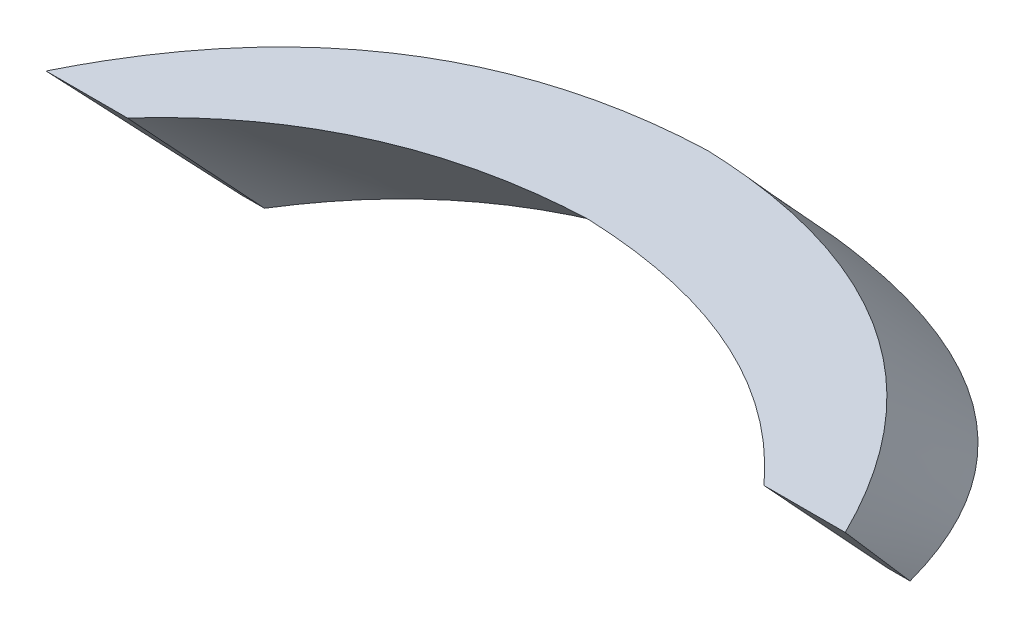
from build123d import *

# Parameters (mm, degrees)
BOSS_EXTRUDE1_DEPTH      = 76.2
BOSS_EXTRUDE2_DEPTH      = 25873.085069
BOSS_EXTRUDE2_DEPTH_BACK = 11480.154931
SKETCH6_R                = 2240.28
SKETCH6_R_2              = 2151.38
CUT_EXTRUDE2_DEPTH       = 40152.227650453
CUT_EXTRUDE2_DEPTH_BACK  = 40152.227650453
SKETCH9_R                = 2603.835118227
SKETCH9_R_2              = 2240.28
SKETCH16_R               = 2240.28
SKETCH17_R               = 355.259859159
SKETCH39_R               = 2240.28
BOSS_EXTRUDE5_DEPTH      = 1158.989431677
SKETCH40_W               = 22247.712993738
SKETCH40_H               = 18439.107036522
CUT_EXTRUDE9_DEPTH       = 47201.096742261


with BuildPart() as part:
    # Sketch4 → Boss-Extrude1 (new body)
    with BuildSketch(Plane(origin=(0, 0, 0), x_dir=(1, 0, 0), z_dir=(0, 1, 0))):
        with BuildLine():
            Line((-2240.28, 11480.154930676), (-2240.28, -25873.085069324))
            add(Edge.make_bspline(
                [(-2240.28, -25873.085069324), (-1878.626183949, -27707.433501437), (0, -28507.09818)],
                knots=[0, 0, 0, 1, 1, 1], degree=2))
            add(Edge.make_bspline(
                [(2240.28, -25873.085069324), (1878.62618395, -27707.433501437), (0, -28507.09818)],
                knots=[0, 0, 0, 1, 1, 1], degree=2))
            Line((2240.28, -25873.085069324), (2240.28, 11480.154930676))
            Line((2240.28, 11480.154930676), (-2240.28, 11480.154930676))
        make_face()
    extrude(amount=BOSS_EXTRUDE1_DEPTH)

    # Sketch6 → Boss-Extrude2 (add, two sides: drawn at the far end of the back side and taken through both)
    with BuildSketch(Plane.XY.offset(-BOSS_EXTRUDE2_DEPTH_BACK)):
        with Locations((0, 609.6)):
            Circle(SKETCH6_R)
        with Locations((0, 609.6)):
            Circle(SKETCH6_R_2, mode=Mode.SUBTRACT)
    extrude(amount=BOSS_EXTRUDE2_DEPTH + BOSS_EXTRUDE2_DEPTH_BACK)

    # Sketch9 → Cut-Extrude2 (cut, two sides: drawn at the far end of the back side and taken through both)
    with BuildSketch(Plane(origin=(0, 0, -11480.154930676), x_dir=(-1, 0, 0), z_dir=(0, 0, -1)).offset(-CUT_EXTRUDE2_DEPTH_BACK)):
        with Locations((0, 609.6)):
            Circle(SKETCH9_R)
        with Locations(Location((0, 609.6, 0), (0, 0, 346.225853002))):
            Circle(SKETCH9_R_2, mode=Mode.SUBTRACT)
    extrude(amount=CUT_EXTRUDE2_DEPTH + CUT_EXTRUDE2_DEPTH_BACK, mode=Mode.SUBTRACT)

    # Sketch16 → Loft1 section 0
    with BuildSketch(Plane.XY.offset(25873.085069324)):
        with Locations((0, 609.6)):
            Circle(SKETCH16_R)
    # Sketch15 → Loft1 section 1
    with BuildSketch(Plane.XY.offset(31657.776596271)):
        with BuildLine():
            add(Edge.make_bspline(
                [(0, 2543.01989867), (915.928720581, 2543.01989867), (2286.858534778, -200.689582198), (0, -503.660012782), (-2286.858534778, -200.689582198), (-915.928720581, 2543.01989867), (0, 2543.01989867)],
                knots=[0, 0, 0, 0, 0.334053834, 0.5, 0.665946166, 1, 1, 1, 1], degree=3))
        make_face()
    # Sketch17 → Loft1 section 2
    with BuildSketch(Plane.XY.offset(34418.206950084)):
        with Locations((0, 1489.004579609)):
            Circle(SKETCH17_R)
    loft()

    # Sketch39 → Boss-Extrude5 (add)
    with BuildSketch(Plane(origin=(0, 0, -11480.154930676), x_dir=(-1, 0, 0), z_dir=(0, 0, -1))):
        with Locations((0, 609.6)):
            Circle(SKETCH39_R)
    extrude(amount=BOSS_EXTRUDE5_DEPTH)

    # Sketch40 → Cut-Extrude9 (cut, through all)
    with BuildSketch(Plane(origin=(0, 0, -12639.144362353), x_dir=(-1, 0, 0), z_dir=(0, 0, -1))):
        Rectangle(SKETCH40_W, SKETCH40_H)
    extrude(amount=-CUT_EXTRUDE9_DEPTH, mode=Mode.SUBTRACT)


with BuildPart() as body_2:
    # Sketch41 → Loft2 section 0
    with BuildSketch(Plane(origin=(0, 2052.629606143, 0), x_dir=(1, 0, 0), z_dir=(0, 1, 0))):
        with BuildLine():
            Line((-1729.620971703, 13800.682850485), (-1377.142886148, 13800.682850485))
            add(Edge.make_bspline(
                [(-1377.142886148, 13800.682850485), (-850.648259402, 14385.325069701), (0, 14418.383322118)],
                knots=[0, 0, 0, 1, 1, 1], degree=2))
            add(Edge.make_bspline(
                [(1377.142886148, 13800.682850485), (850.648259402, 14385.325069701), (0, 14418.383322118)],
                knots=[0, 0, 0, 1, 1, 1], degree=2))
            Line((1377.142886148, 13800.682850485), (1729.620971703, 13800.682850485))
            add(Edge.make_bspline(
                [(1729.620971703, 13800.682850485), (1193.606895017, 14891.192200236), (0, 14934.455787556)],
                knots=[0, 0, 0, 1, 1, 1], degree=2))
            add(Edge.make_bspline(
                [(-1729.620971703, 13800.682850485), (-1193.606895017, 14891.192200236), (0, 14934.455787556)],
                knots=[0, 0, 0, 1, 1, 1], degree=2))
        make_face()
    # Sketch42 → Loft2 section 1
    with BuildSketch(Plane(origin=(0, 1447.99219123, 0), x_dir=(1, 0, 0), z_dir=(0, 1, 0))):
        with BuildLine():
            Line((-1447.374386664, 14363.482994407), (-1346.847413691, 14363.482994407))
            add(Edge.make_bspline(
                [(-1346.847413691, 14363.482994407), (-892.254112883, 15093.527338448), (0, 15180.088861613)],
                knots=[0, 0, 0, 1, 1, 1], degree=2))
            add(Edge.make_bspline(
                [(1346.847413691, 14363.482994407), (892.254112883, 15093.527338448), (0, 15180.088861613)],
                knots=[0, 0, 0, 1, 1, 1], degree=2))
            Line((1346.847413691, 14363.482994407), (1447.374386664, 14363.482994407))
            add(Edge.make_bspline(
                [(1447.374386664, 14363.482994407), (1182.130026726, 15348.85351601), (0, 15488.706628883)],
                knots=[0, 0, 0, 1, 1, 1], degree=2))
            add(Edge.make_bspline(
                [(-1447.374386664, 14363.482994407), (-1182.130026726, 15348.85351601), (0, 15488.706628883)],
                knots=[0, 0, 0, 1, 1, 1], degree=2))
        make_face()
    loft()


solid = body_2.part
